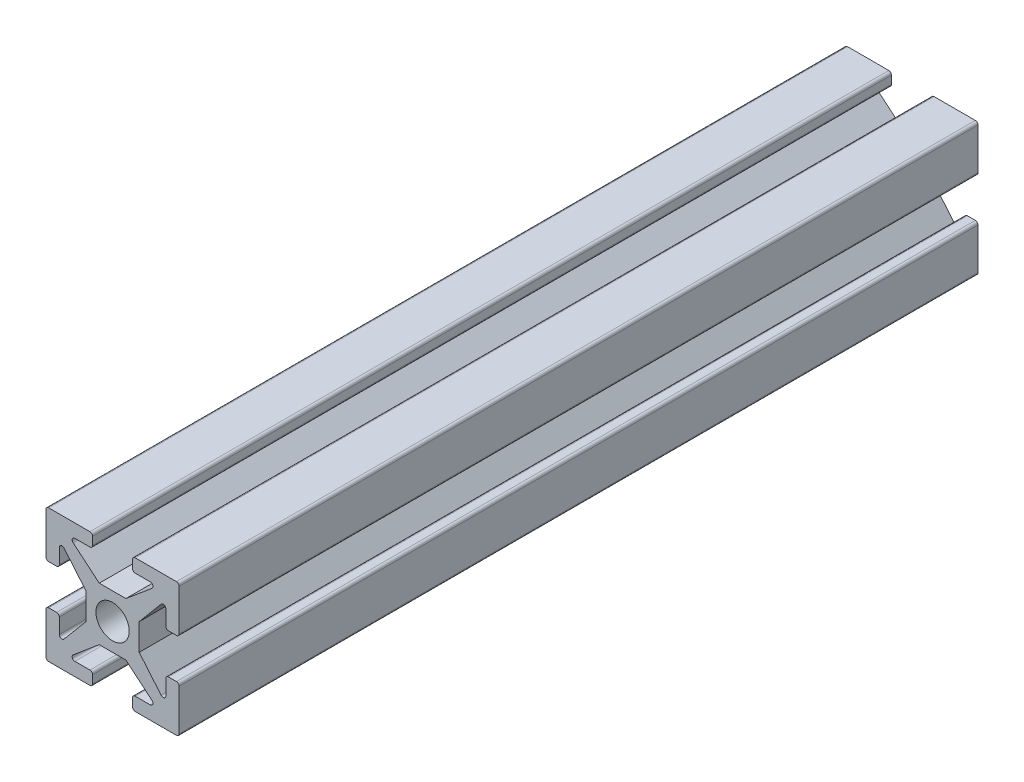
from build123d import *

# Parameters (mm, degrees)
SKETCH1_R           = 1.25
BOSS_EXTRUDE1_DEPTH = 60


with BuildPart() as part:
    # Sketch1 → Boss-Extrude1 (new body)
    with BuildSketch(Plane.XY):
        with BuildLine():
            Line((-4.8, 5), (-1.7, 5))
            ThreePointArc((-1.7, 5), (-1.558578644, 4.941421356), (-1.5, 4.8))
            Line((-1.5, 4.8), (-1.5, 4.2))
            ThreePointArc((-1.5, 4.2), (-1.558578644, 4.058578644), (-1.7, 4))
            Line((-1.7, 4), (-2.834011701, 4))
            ThreePointArc((-2.834011701, 4), (-3.021950225, 3.868404029), (-2.962569223, 3.646791111))
            Line((-2.962569223, 3.646791111), (-1, 2))
            Line((-1, 2), (1, 2))
            Line((1, 2), (2.962569223, 3.646791111))
            ThreePointArc((2.962569223, 3.646791111), (3.021950225, 3.868404029), (2.834011701, 4))
            Line((2.834011701, 4), (1.7, 4))
            ThreePointArc((1.7, 4), (1.558578644, 4.058578644), (1.5, 4.2))
            Line((1.5, 4.2), (1.5, 4.8))
            ThreePointArc((1.5, 4.8), (1.558578644, 4.941421356), (1.7, 5))
            Line((1.7, 5), (4.8, 5))
            ThreePointArc((4.8, 5), (4.941421356, 4.941421356), (5, 4.8))
            Line((5, 4.8), (5, 1.7))
            ThreePointArc((5, 1.7), (4.941421356, 1.558578644), (4.8, 1.5))
            Line((4.8, 1.5), (4.2, 1.5))
            ThreePointArc((4.2, 1.5), (4.058578644, 1.558578644), (4, 1.7))
            Line((4, 1.7), (4, 2.834011701))
            ThreePointArc((4, 2.834011701), (3.868404029, 3.021950225), (3.646791111, 2.962569223))
            Line((3.646791111, 2.962569223), (2, 1))
            Line((2, 1), (2, -1))
            Line((2, -1), (3.646791111, -2.962569223))
            ThreePointArc((3.646791111, -2.962569223), (3.868404029, -3.021950225), (4, -2.834011701))
            Line((4, -2.834011701), (4, -1.7))
            ThreePointArc((4, -1.7), (4.058578644, -1.558578644), (4.2, -1.5))
            Line((4.2, -1.5), (4.8, -1.5))
            ThreePointArc((4.8, -1.5), (4.941421356, -1.558578644), (5, -1.7))
            Line((5, -1.7), (5, -4.8))
            ThreePointArc((5, -4.8), (4.941421356, -4.941421356), (4.8, -5))
            Line((4.8, -5), (1.7, -5))
            ThreePointArc((1.7, -5), (1.558578644, -4.941421356), (1.5, -4.8))
            Line((1.5, -4.8), (1.5, -4.2))
            ThreePointArc((1.5, -4.2), (1.558578644, -4.058578644), (1.7, -4))
            Line((1.7, -4), (2.834011701, -4))
            ThreePointArc((2.834011701, -4), (3.021950225, -3.868404029), (2.962569223, -3.646791111))
            Line((2.962569223, -3.646791111), (1, -2))
            Line((1, -2), (-1, -2))
            Line((-1, -2), (-2.962569223, -3.646791111))
            ThreePointArc((-2.962569223, -3.646791111), (-3.021950225, -3.868404029), (-2.834011701, -4))
            Line((-2.834011701, -4), (-1.7, -4))
            ThreePointArc((-1.7, -4), (-1.558578644, -4.058578644), (-1.5, -4.2))
            Line((-1.5, -4.2), (-1.5, -4.8))
            ThreePointArc((-1.5, -4.8), (-1.558578644, -4.941421356), (-1.7, -5))
            Line((-1.7, -5), (-4.8, -5))
            ThreePointArc((-4.8, -5), (-4.941421356, -4.941421356), (-5, -4.8))
            Line((-5, -4.8), (-5, -1.7))
            ThreePointArc((-5, -1.7), (-4.941421356, -1.558578644), (-4.8, -1.5))
            Line((-4.8, -1.5), (-4.2, -1.5))
            ThreePointArc((-4.2, -1.5), (-4.058578644, -1.558578644), (-4, -1.7))
            Line((-4, -1.7), (-4, -2.834011701))
            ThreePointArc((-4, -2.834011701), (-3.868404029, -3.021950225), (-3.646791111, -2.962569223))
            Line((-3.646791111, -2.962569223), (-2, -1))
            Line((-2, -1), (-2, 1))
            Line((-2, 1), (-3.646791111, 2.962569223))
            ThreePointArc((-3.646791111, 2.962569223), (-3.868404029, 3.021950225), (-4, 2.834011701))
            Line((-4, 2.834011701), (-4, 1.7))
            ThreePointArc((-4, 1.7), (-4.058578644, 1.558578644), (-4.2, 1.5))
            Line((-4.2, 1.5), (-4.8, 1.5))
            ThreePointArc((-4.8, 1.5), (-4.941421356, 1.558578644), (-5, 1.7))
            Line((-5, 1.7), (-5, 4.8))
            ThreePointArc((-5, 4.8), (-4.941421356, 4.941421356), (-4.8, 5))
        make_face()
        Circle(SKETCH1_R, mode=Mode.SUBTRACT)
    extrude(amount=BOSS_EXTRUDE1_DEPTH)


solid = part.part
